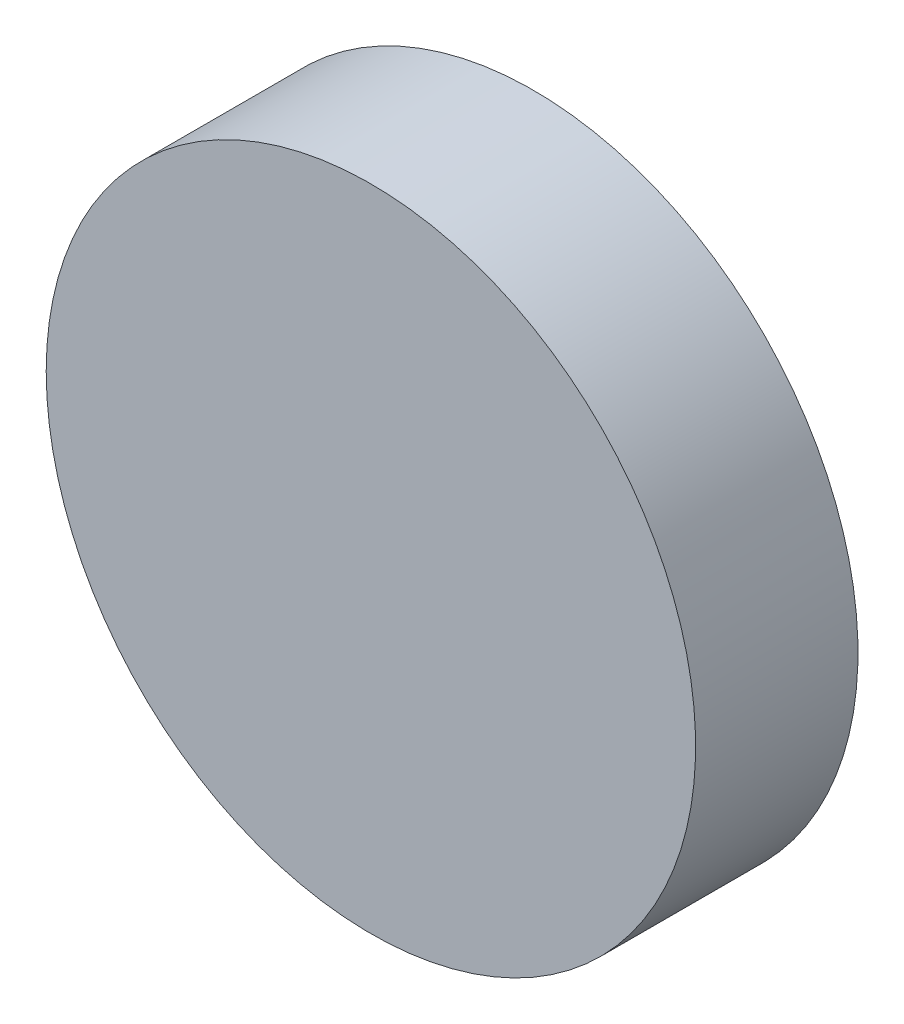
from build123d import *

# Parameters (mm, degrees)
SKETCH_1_R      = 52
EXTRUDE_1_DEPTH = 26


with BuildPart() as part:
    # 草图1 → 凸台-拉伸1 (new body)
    with BuildSketch(Plane.XY):
        with Locations(Location((0, 0, 0), (0, 0, 180))):
            Circle(SKETCH_1_R)
    extrude(amount=EXTRUDE_1_DEPTH)


solid = part.part
